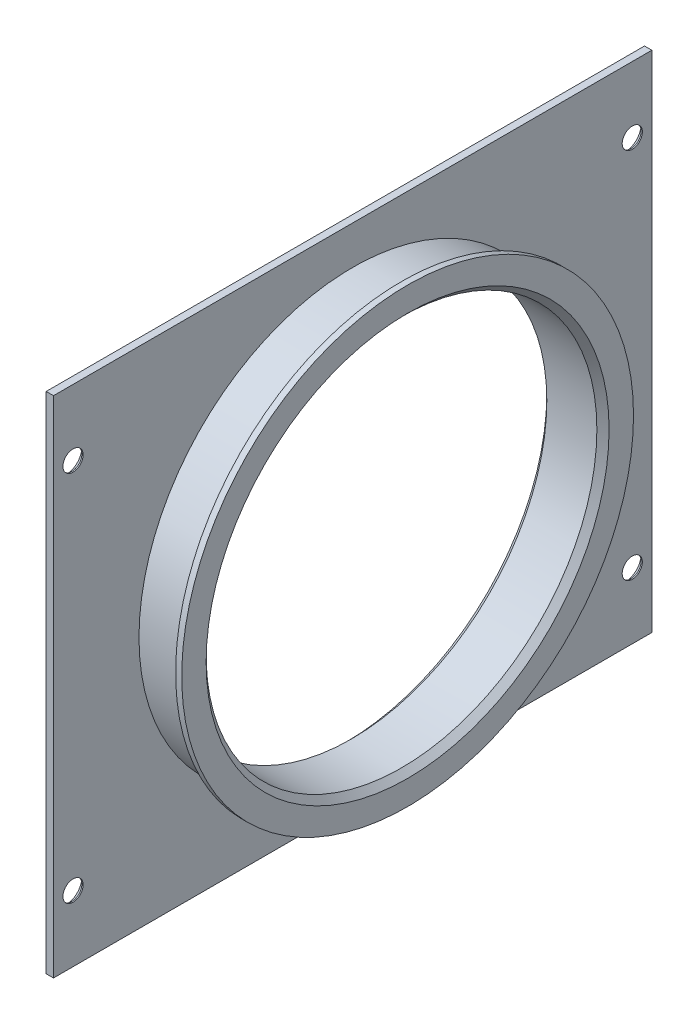
from build123d import *

# Parameters (mm, degrees)
SKETCH1_W           = 82.6
SKETCH1_H           = 98
BOSS_EXTRUDE1_DEPTH = 1.2
SKETCH2_R           = 1.65
CUT_EXTRUDE1_DEPTH  = 129.172539961
SKETCH3_R           = 35
BOSS_EXTRUDE2_DEPTH = 8
SKETCH4_R           = 37
BOSS_EXTRUDE3_DEPTH = 1
SKETCH5_R           = 32
CUT_EXTRUDE2_DEPTH  = 129.572158728
CHAMFER1_SIZE       = 1
CHAMFER2_SIZE       = 1


with BuildPart() as part:
    # Sketch1 → Boss-Extrude1 (new body)
    with BuildSketch(Plane.YZ):
        with Locations((41.3, 49)):
            Rectangle(SKETCH1_W, SKETCH1_H)
    extrude(amount=BOSS_EXTRUDE1_DEPTH)

    # Sketch2 → Cut-Extrude1 (cut, through all)
    with BuildSketch(Plane.YZ.offset(1.2)):
        with Locations(Location((10.8, 94.8, 0), (0, 0, 270))):
            Circle(SKETCH2_R)
        with Locations(Location((71.8, 94.8, 0), (0, 0, 270))):
            Circle(SKETCH2_R)
        with Locations(Location((10.8, 3.2, 0), (0, 0, 270))):
            Circle(SKETCH2_R)
        with Locations(Location((71.8, 3.2, 0), (0, 0, 270))):
            Circle(SKETCH2_R)
    extrude(amount=-CUT_EXTRUDE1_DEPTH, mode=Mode.SUBTRACT)

    # Sketch3 → Boss-Extrude2 (add)
    with BuildSketch(Plane.YZ.offset(1.2)):
        with Locations(Location((41.3, 49, 0), (0, 0, 270))):
            Circle(SKETCH3_R)
    extrude(amount=BOSS_EXTRUDE2_DEPTH)

    # Sketch4 → Boss-Extrude3 (add)
    with BuildSketch(Plane.YZ.offset(9.2)):
        with Locations(Location((41.3, 49, 0), (0, 0, 270))):
            Circle(SKETCH4_R)
    extrude(amount=BOSS_EXTRUDE3_DEPTH)

    # Sketch5 → Cut-Extrude2 (cut, through all)
    with BuildSketch(Plane.YZ.offset(10.2)):
        with Locations(Location((41.3, 49, 0), (0, 0, 270))):
            Circle(SKETCH5_R)
    extrude(amount=-CUT_EXTRUDE2_DEPTH, mode=Mode.SUBTRACT)

    # Chamfer1
    chamfer1_edges = [part.edges().sort_by_distance(p)[0] for p in [
        (0, 71.8, 96.45),
        (0, 10.8, 4.85),
        (0, 71.8, 4.85),
        (0, 10.8, 96.45),
    ]]
    chamfer(chamfer1_edges, length=CHAMFER1_SIZE)

    # Chamfer2
    chamfer2_edges = [part.edges().sort_by_distance(p)[0] for p in [
        (0, 41.3, 81),
        (10.2, 41.3, 81),
    ]]
    chamfer(chamfer2_edges, length=CHAMFER2_SIZE)


solid = part.part
